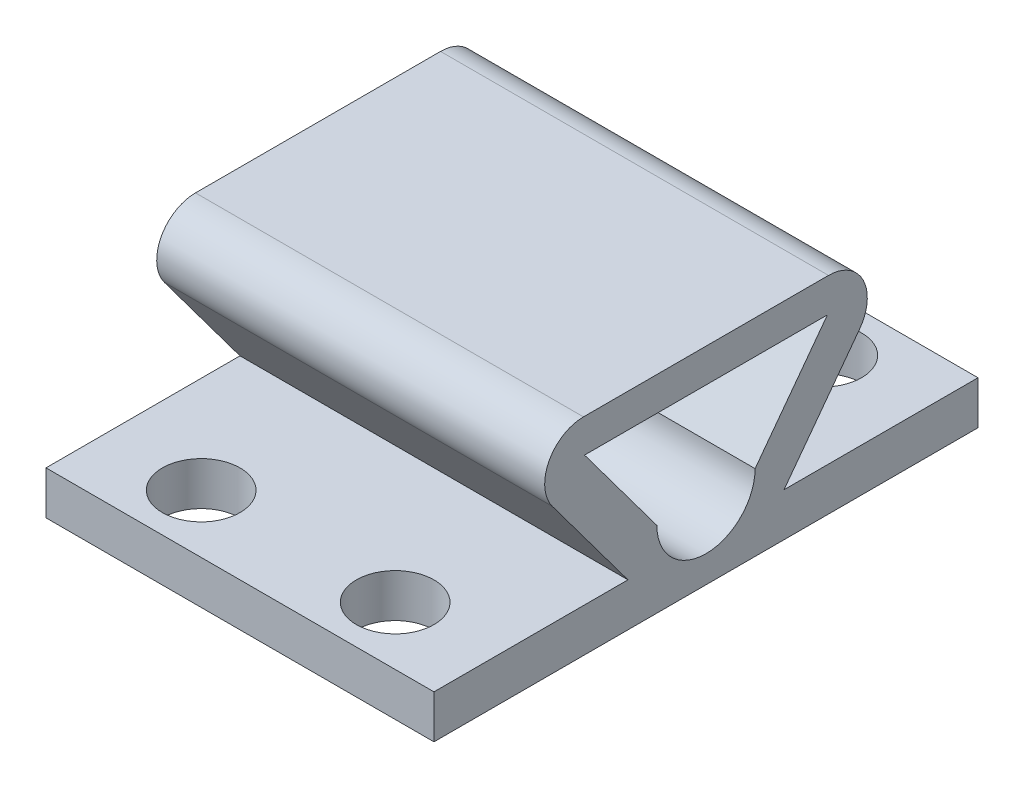
from build123d import *

# Parameters (mm, degrees)
BOSS_EXTRUDE2_DEPTH = 25.4
SKETCH13_R          = 2.54
CUT_EXTRUDE4_DEPTH  = 6.35
SKETCH12_R          = 2.54
CUT_EXTRUDE5_DEPTH  = 6.35
SKETCH14_R          = 2.54
CUT_EXTRUDE6_DEPTH  = 6.35
BOSS_EXTRUDE3_DEPTH = 2.54
FILLET1_R           = 2.54
FILLET2_R           = 2.54
SKETCH18_R          = 3.175
CUT_EXTRUDE7_DEPTH  = 2.54


with BuildPart() as part:
    # Sketch6 → Boss-Extrude2 (new body)
    with BuildSketch(Plane(origin=(0, 0, 0), x_dir=(0, 0, -1), z_dir=(1, 0, 0))):
        Polygon((13.082661166, -7.52885515), (-13.082661166, -7.52885515), (-5.10893156, -18.225236378), (-17.80893156, -18.225236378), (-17.80893156, -21.061645655), (17.80893156, -21.061645655), (17.80893156, -18.225236378), (5.10893156, -18.225236378), align=None)
        with BuildLine():
            Line((3.81, -9.731855656), (7.950045252, -9.731855656))
            Line((7.950045252, -9.731855656), (3.216371131, -16.081855656))
            ThreePointArc((3.216371131, -16.081855656), (0, -19.298226787), (-3.216371131, -16.081855656))
            Line((-3.216371131, -16.081855656), (-7.950045252, -9.731855656))
            Line((-7.950045252, -9.731855656), (-3.81, -9.731855656))
            Line((-3.81, -9.731855656), (3.81, -9.731855656))
        make_face(mode=Mode.SUBTRACT)
    extrude(amount=BOSS_EXTRUDE2_DEPTH)

    # Sketch13 → Cut-Extrude4 (cut)
    with BuildSketch(Plane(origin=(0, -18.225236378, 0), x_dir=(1, 0, 0), z_dir=(0, 1, 0))):
        with Locations((19.05, -13.99893156)):
            Circle(SKETCH13_R)
    extrude(amount=-CUT_EXTRUDE4_DEPTH, mode=Mode.SUBTRACT)

    # Sketch12 → Cut-Extrude5 (cut)
    with BuildSketch(Plane(origin=(0, -18.225236378, 0), x_dir=(1, 0, 0), z_dir=(0, 1, 0))):
        with Locations((6.35, -13.99893156)):
            Circle(SKETCH12_R)
    extrude(amount=-CUT_EXTRUDE5_DEPTH, mode=Mode.SUBTRACT)

    # Sketch14 → Cut-Extrude6 (cut)
    with BuildSketch(Plane(origin=(0, -18.225236378, 0), x_dir=(1, 0, 0), z_dir=(0, 1, 0))):
        with Locations((19.05, 13.99893156)):
            Circle(SKETCH14_R)
        with Locations((6.35, 13.99893156)):
            Circle(SKETCH14_R)
    extrude(amount=-CUT_EXTRUDE6_DEPTH, mode=Mode.SUBTRACT)

    # Sketch6<4> → Boss-Extrude3 (add)
    with BuildSketch(Plane(origin=(0, 0, 0), x_dir=(0, 0, -1), z_dir=(1, 0, 0))):
        with BuildLine():
            Line((7.950045252, -9.731855656), (3.216371131, -16.081855656))
            ThreePointArc((3.216371131, -16.081855656), (0, -19.298226787), (-3.216371131, -16.081855656))
            Line((-3.216371131, -16.081855656), (-7.950045252, -9.731855656))
            Line((-7.950045252, -9.731855656), (-3.81, -9.731855656))
            Line((-3.81, -9.731855656), (3.81, -9.731855656))
            Line((3.81, -9.731855656), (7.950045252, -9.731855656))
        make_face()
    extrude(amount=BOSS_EXTRUDE3_DEPTH)

    # Fillet1
    fillet1_edges = [part.edges().sort_by_distance(p)[0] for p in [
        (12.7, -7.52885515, 13.082661166),
    ]]
    fillet(fillet1_edges, radius=FILLET1_R)

    # Fillet2
    fillet2_edges = [part.edges().sort_by_distance(p)[0] for p in [
        (12.7, -7.52885515, -13.082661166),
    ]]
    fillet(fillet2_edges, radius=FILLET2_R)

    # Sketch18 → Cut-Extrude7 (cut)
    with BuildSketch(Plane.ZY):
        with Locations((0, -16.081855656)):
            Circle(SKETCH18_R)
    extrude(amount=-CUT_EXTRUDE7_DEPTH, mode=Mode.SUBTRACT)


solid = part.part
